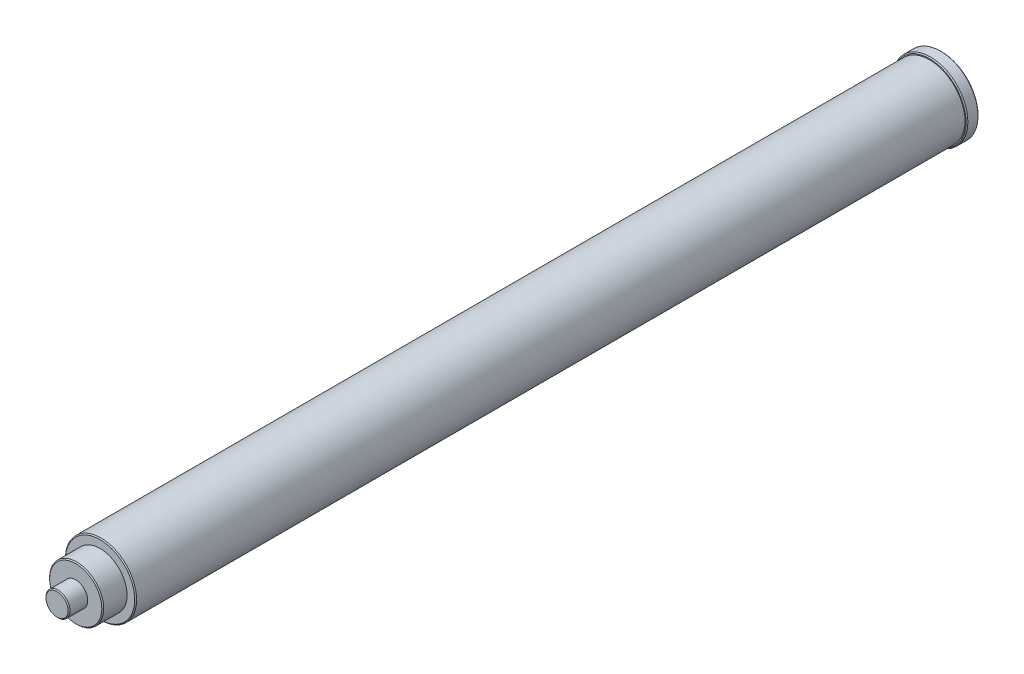
from build123d import *

# Parameters (mm, degrees)
SKETCH1_R           = 39.6875
BOSS_EXTRUDE1_DEPTH = 12.7
SKETCH2_R           = 37.6555
BOSS_EXTRUDE2_DEPTH = 877.2906
SKETCH3_R           = 28.575
BOSS_EXTRUDE3_DEPTH = 25.7048
SKETCH4_R           = 12.7
BOSS_EXTRUDE4_DEPTH = 19.7358
CHAMFER1_SIZE       = 1


with BuildPart() as part:
    # Sketch1 → Boss-Extrude1 (new body)
    with BuildSketch(Plane.XY):
        Circle(SKETCH1_R)
    extrude(amount=BOSS_EXTRUDE1_DEPTH)

    # Sketch2 → Boss-Extrude2 (add)
    with BuildSketch(Plane.XY.offset(12.7)):
        Circle(SKETCH2_R)
    extrude(amount=BOSS_EXTRUDE2_DEPTH)

    # Sketch3 → Boss-Extrude3 (add)
    with BuildSketch(Plane.XY.offset(889.9906)):
        Circle(SKETCH3_R)
    extrude(amount=BOSS_EXTRUDE3_DEPTH)

    # Sketch4 → Boss-Extrude4 (add)
    with BuildSketch(Plane.XY.offset(915.6954)):
        with Locations(Location((0, 0, 0), (0, 0, 180))):
            Circle(SKETCH4_R)
    extrude(amount=BOSS_EXTRUDE4_DEPTH)

    # Chamfer1
    chamfer1_edges = [part.edges().sort_by_distance(p)[0] for p in [
        (-28.575, 0, 915.6954),
        (12.7, 0, 935.4312),
        (-39.6875, 0, 0),
        (-39.6875, 0, 12.7),
        (-37.6555, 0, 889.9906),
    ]]
    chamfer(chamfer1_edges, length=CHAMFER1_SIZE)


solid = part.part
